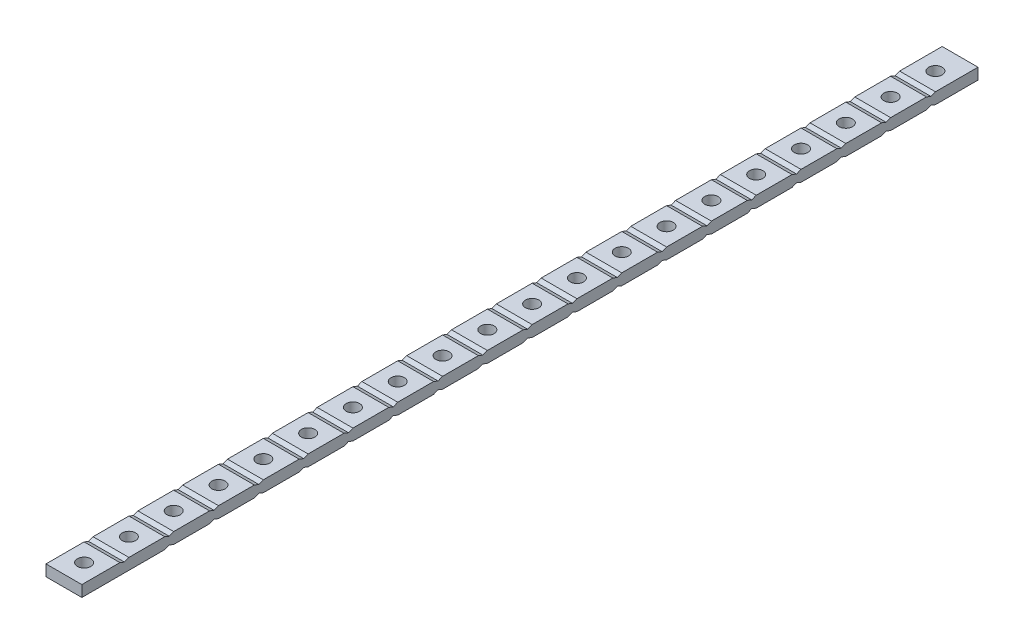
from build123d import *

# Parameters (mm, degrees)
SKETCH1_W           = 8
SKETCH1_H           = 200
BOSS_EXTRUDE1_DEPTH = 2.5
SKETCH2_R           = 1.5
CUT_EXTRUDE1_DEPTH  = 196.656868011
CUT_EXTRUDE2_DEPTH  = 196.779493308


with BuildPart() as part:
    # Sketch1 → Boss-Extrude1 (new body)
    with BuildSketch(Plane(origin=(0, 0, 0), x_dir=(1, 0, 0), z_dir=(0, 1, 0))):
        with Locations((0, 95.6)):
            Rectangle(SKETCH1_W, SKETCH1_H)
    extrude(amount=BOSS_EXTRUDE1_DEPTH)

    # Sketch2 → Cut-Extrude1 (cut, through all)
    with BuildSketch(Plane(origin=(0, 2.5, 0), x_dir=(1, 0, 0), z_dir=(0, 1, 0))):
        with Locations(Location((0, 0.1, 0), (0, 0, 270))):
            Circle(SKETCH2_R)
        with Locations(Location((0, 10.1, 0), (0, 0, 270))):
            Circle(SKETCH2_R)
        with Locations(Location((0, 20.1, 0), (0, 0, 270))):
            Circle(SKETCH2_R)
        with Locations(Location((0, 30.1, 0), (0, 0, 270))):
            Circle(SKETCH2_R)
        with Locations(Location((0, 40.1, 0), (0, 0, 270))):
            Circle(SKETCH2_R)
        with Locations(Location((0, 50.1, 0), (0, 0, 270))):
            Circle(SKETCH2_R)
        with Locations(Location((0, 60.1, 0), (0, 0, 270))):
            Circle(SKETCH2_R)
        with Locations(Location((0, 70.1, 0), (0, 0, 270))):
            Circle(SKETCH2_R)
        with Locations(Location((0, 80.1, 0), (0, 0, 270))):
            Circle(SKETCH2_R)
        with Locations(Location((0, 90.1, 0), (0, 0, 270))):
            Circle(SKETCH2_R)
        with Locations(Location((0, 100.1, 0), (0, 0, 270))):
            Circle(SKETCH2_R)
        with Locations(Location((0, 110.1, 0), (0, 0, 270))):
            Circle(SKETCH2_R)
        with Locations(Location((0, 120.1, 0), (0, 0, 270))):
            Circle(SKETCH2_R)
        with Locations(Location((0, 130.1, 0), (0, 0, 270))):
            Circle(SKETCH2_R)
        with Locations(Location((0, 140.1, 0), (0, 0, 270))):
            Circle(SKETCH2_R)
        with Locations(Location((0, 150.1, 0), (0, 0, 270))):
            Circle(SKETCH2_R)
        with Locations(Location((0, 160.1, 0), (0, 0, 270))):
            Circle(SKETCH2_R)
        with Locations(Location((0, 170.1, 0), (0, 0, 270))):
            Circle(SKETCH2_R)
        with Locations(Location((0, 180.1, 0), (0, 0, 270))):
            Circle(SKETCH2_R)
        with Locations(Location((0, 190.1, 0), (0, 0, 270))):
            Circle(SKETCH2_R)
    extrude(amount=-CUT_EXTRUDE1_DEPTH, mode=Mode.SUBTRACT)

    # Sketch3 → Cut-Extrude2 (cut, through all)
    with BuildSketch(Plane(origin=(4, 0, 0), x_dir=(0, 0, -1), z_dir=(1, 0, 0))):
        Polygon((26.1, 2.5), (24.1, 2.5), (25.1, 2.1), align=None)
        Polygon((35.1, 0.4), (34.1, 0), (36.1, 0), align=None)
        Polygon((45.1, 0.4), (44.1, 0), (46.1, 0), align=None)
        Polygon((55.1, 0.4), (54.1, 0), (56.1, 0), align=None)
        Polygon((6.1, 2.5), (4.1, 2.5), (5.1, 2.1), align=None)
        Polygon((16.1, 2.5), (14.1, 2.5), (15.1, 2.1), align=None)
        Polygon((15.1, 0.4), (16.1, 0), (14.1, 0), align=None)
        Polygon((25.1, 0.4), (26.1, 0), (24.1, 0), align=None)
        Polygon((36.1, 2.5), (34.1, 2.5), (35.1, 2.1), align=None)
        Polygon((46.1, 2.5), (44.1, 2.5), (45.1, 2.1), align=None)
        Polygon((56.1, 2.5), (54.1, 2.5), (55.1, 2.1), align=None)
        Polygon((64.1, 2.5), (65.1, 2.1), (66.1, 2.5), align=None)
        Polygon((66.1, 0), (64.1, 0), (65.1, 0.4), align=None)
        Polygon((76.1, 2.5), (74.1, 2.5), (75.1, 2.1), align=None)
        Polygon((75.1, 0.4), (76.1, 0), (74.1, 0), align=None)
        Polygon((86.1, 2.5), (84.1, 2.5), (85.1, 2.1), align=None)
        Polygon((85.1, 0.4), (86.1, 0), (84.1, 0), align=None)
        Polygon((96.1, 2.5), (94.1, 2.5), (95.1, 2.1), align=None)
        Polygon((95.1, 0.4), (96.1, 0), (94.1, 0), align=None)
        Polygon((106.1, 2.5), (104.1, 2.5), (105.1, 2.1), align=None)
        Polygon((105.1, 0.4), (106.1, 0), (104.1, 0), align=None)
        Polygon((116.1, 2.5), (114.1, 2.5), (115.1, 2.1), align=None)
        Polygon((115.1, 0.4), (116.1, 0), (114.1, 0), align=None)
        Polygon((126.1, 2.5), (124.1, 2.5), (125.1, 2.1), align=None)
        Polygon((125.1, 0.4), (126.1, 0), (124.1, 0), align=None)
        Polygon((136.1, 2.5), (134.1, 2.5), (135.1, 2.1), align=None)
        Polygon((135.1, 0.4), (136.1, 0), (134.1, 0), align=None)
        Polygon((146.1, 2.5), (144.1, 2.5), (145.1, 2.1), align=None)
        Polygon((145.1, 0.4), (146.1, 0), (144.1, 0), align=None)
        Polygon((156.1, 2.5), (154.1, 2.5), (155.1, 2.1), align=None)
        Polygon((155.1, 0.4), (156.1, 0), (154.1, 0), align=None)
        Polygon((166.1, 2.5), (164.1, 2.5), (165.1, 2.1), align=None)
        Polygon((166.1, 0), (164.1, 0), (165.1, 0.4), align=None)
        Polygon((176.1, 2.5), (174.1, 2.5), (175.1, 2.1), align=None)
        Polygon((175.1, 0.4), (176.1, 0), (174.1, 0), align=None)
        Polygon((186.1, 2.5), (184.1, 2.5), (185.1, 2.1), align=None)
        Polygon((185.1, 0.4), (186.1, 0), (184.1, 0), align=None)
    extrude(amount=-CUT_EXTRUDE2_DEPTH, mode=Mode.SUBTRACT)


solid = part.part
